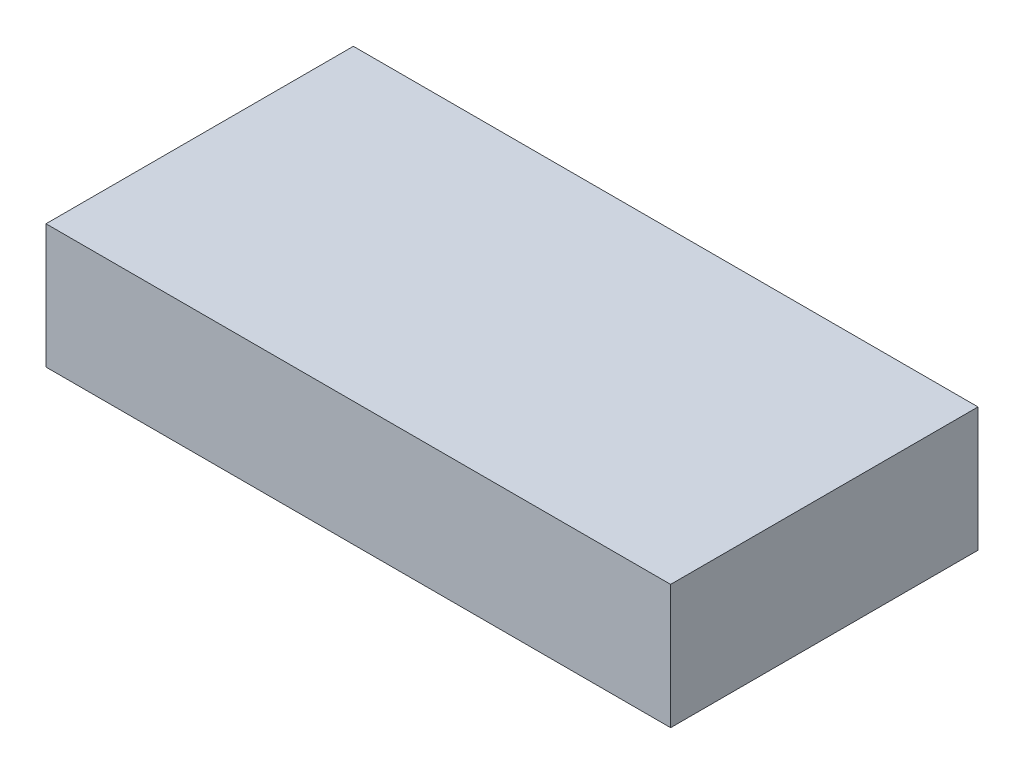
from build123d import *

# Parameters (mm, degrees)
SKETCH1_W           = 15.85
SKETCH1_H           = 7.8
BOSS_EXTRUDE1_DEPTH = 3.15
SHELL1_T            = -1.5


with BuildPart() as part:
    # Sketch1 → Boss-Extrude1 (new body)
    with BuildSketch(Plane(origin=(0, 0, 0), x_dir=(1, 0, 0), z_dir=(0, 1, 0))):
        Rectangle(SKETCH1_W, SKETCH1_H)
    extrude(amount=-BOSS_EXTRUDE1_DEPTH)

    # Shell1
    shell1_openings = [part.faces().sort_by_distance(p)[0] for p in [
        (0, -3.15, 0),
    ]]
    offset(amount=SHELL1_T, openings=shell1_openings, kind=Kind.INTERSECTION)


solid = part.part
